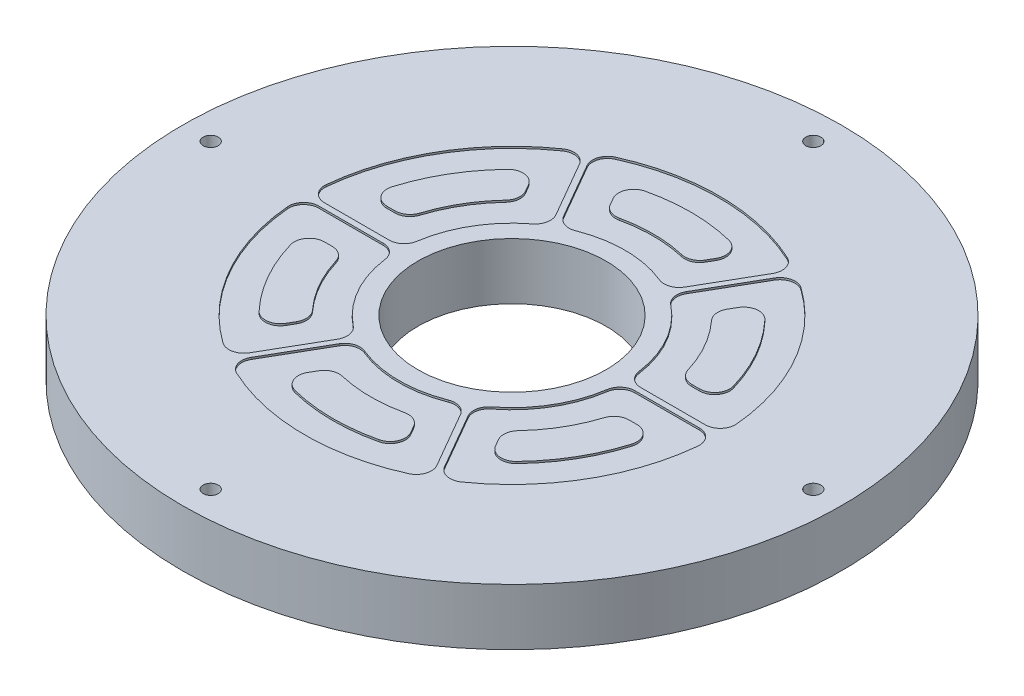
from build123d import *

# Parameters (mm, degrees)
SKETCH2_R           = 175
BOSS_EXTRUDE1_DEPTH = 15
SKETCH3_R           = 4
SKETCH3_R_2         = 50
CUT_EXTRUDE1_DEPTH  = 30
CUT_EXTRUDE3_DEPTH  = 1
CIRPATTERN2_COUNT   = 6


with BuildPart() as part:
    # Sketch2 → Boss-Extrude1 (new, symmetric)
    with BuildSketch(Plane(origin=(0, 0, 0), x_dir=(1, 0, 0), z_dir=(0, 1, 0))):
        with Locations(Location((0, 0, 0), (0, 0, 270))):
            Circle(SKETCH2_R)
    extrude(amount=BOSS_EXTRUDE1_DEPTH, both=True)

    # Sketch3 → Cut-Extrude1 (cut)
    with BuildSketch(Plane(origin=(0, 15, 0), x_dir=(1, 0, 0), z_dir=(0, 1, 0))):
        with Locations(Location((0, 160, 0), (0, 0, 270))):
            Circle(SKETCH3_R)
        with Locations(Location((0, -160, 0), (0, 0, 90))):
            Circle(SKETCH3_R)
        with Locations(Location((-160, 0, 0), (0, 0, 270))):
            Circle(SKETCH3_R)
        with Locations(Location((160, 0, 0), (0, 0, 90))):
            Circle(SKETCH3_R)
        with Locations(Location((0, 0, 0), (0, 0, 270))):
            Circle(SKETCH3_R_2)
    extrude(amount=-CUT_EXTRUDE1_DEPTH, mode=Mode.SUBTRACT)

    # Sketch4 → Cut-Extrude3 (cut)
    with BuildSketch(Plane(origin=(0, 15, 0), x_dir=(1, 0, 0), z_dir=(0, 1, 0))):
        with BuildLine():
            ThreePointArc((-36.613340144, 47.533812423), (-51.737318493, 30.385027154), (-59.347664897, 8.823529412))
            ThreePointArc((-59.347664897, 8.823529412), (-62.036309634, 3.941462028), (-67.260686883, 2))
            Line((-67.260686883, 2), (-101.508620324, 2))
            ThreePointArc((-101.508620324, 2), (-107.436288913, 4.627594105), (-109.470080741, 10.784313725))
            ThreePointArc((-109.470080741, 10.784313725), (-94.99085495, 55.468346611), (-63.19102199, 90.038295963))
            ThreePointArc((-63.19102199, 90.038295963), (-56.868026794, 91.301361412), (-51.667108069, 87.490056256))
            Line((-51.667108069, 87.490056256), (-34.5669156, 57.87165408))
            ThreePointArc((-34.5669156, 57.87165408), (-33.647401917, 52.31816148), (-36.613340144, 47.533812423))
        make_face()
        with BuildLine():
            ThreePointArc((-55.668486055, 64.420646227), (-61.622662682, 68.361129347), (-68.352706691, 65.97656772))
            ThreePointArc((-68.352706691, 65.97656772), (-81.986434608, 47.991921614), (-90.993256658, 27.298850575))
            ThreePointArc((-90.993256658, 27.298850575), (-89.749031081, 20.224584028), (-83.330666624, 17))
            Line((-83.330666624, 17), (-79.14543575, 17))
            ThreePointArc((-79.14543575, 17), (-74.41664671, 18.547205705), (-71.516960015, 22.590361446))
            ThreePointArc((-71.516960015, 22.590361446), (-64.714174788, 37.908779742), (-54.679341331, 51.333903335))
            ThreePointArc((-54.679341331, 51.333903335), (-52.564762349, 55.890540621), (-53.583601177, 60.80951969))
            Line((-53.583601177, 60.80951969), (-55.668486055, 64.420646227))
        make_face(mode=Mode.SUBTRACT)
    cut_extrude3 = extrude(amount=-CUT_EXTRUDE3_DEPTH, mode=Mode.SUBTRACT)

    # CirPattern2: Cut-Extrude3 ×6 about axis
    cirpattern2_axis = Axis((0, 0, 0), (0, 1, 0))
    for i in range(1, CIRPATTERN2_COUNT):
        add(cut_extrude3.rotate(cirpattern2_axis, i * 360 / CIRPATTERN2_COUNT), mode=Mode.SUBTRACT)


solid = part.part
